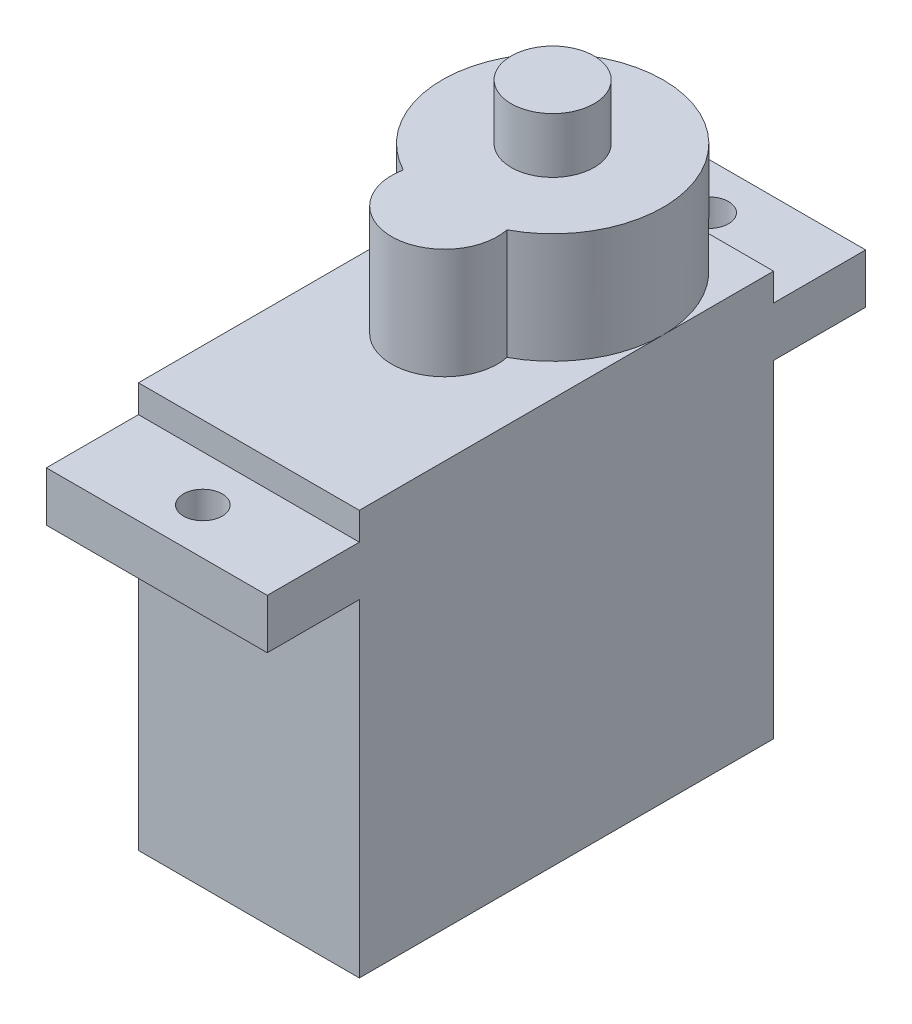
from build123d import *

# Parameters (mm, degrees)
SKETCH1_W           = 5
SKETCH1_H           = 2.7
SKETCH1_W_2         = 14.75
SKETCH1_H_2         = 6
BOSS_EXTRUDE1_DEPTH = 12
CUT_EXTRUDE1_DEPTH  = 6
SKETCH3_R           = 1.05
CUT_EXTRUDE2_DEPTH  = 2.7
SKETCH4_R           = 2.25
BOSS_EXTRUDE3_DEPTH = 3


with BuildPart() as part:
    # Sketch1 → Boss-Extrude1 (new body)
    with BuildSketch(Plane(origin=(0, 0, 0), x_dir=(0, 0, -1), z_dir=(1, 0, 0))):
        Polygon((-11.25, 6.8), (-11.25, -11), (11.25, -11), (11.25, 6.8), (11.25, 9.5), (11.25, 11), (-3.5, 11), (-11.25, 11), (-11.25, 9.5), align=None)
        with Locations((-13.75, 8.15)):
            Rectangle(SKETCH1_W, SKETCH1_H)
        with Locations((13.75, 8.15)):
            Rectangle(SKETCH1_W, SKETCH1_H)
        with Locations((3.875, 14)):
            Rectangle(SKETCH1_W_2, SKETCH1_H_2)
    extrude(amount=BOSS_EXTRUDE1_DEPTH)

    # Sketch2 → Cut-Extrude1 (cut)
    with BuildSketch(Plane(origin=(0, 17, 0), x_dir=(1, 0, 0), z_dir=(0, 1, 0))):
        with BuildLine():
            ThreePointArc((0, 5.25), (1.757359313, 9.492640687), (6, 11.25))
            Line((6, 11.25), (0, 11.25))
            Line((0, 11.25), (0, 5.25))
        make_face()
        with BuildLine():
            Line((12, 11.25), (6, 11.25))
            ThreePointArc((6, 11.25), (10.242640687, 9.492640687), (12, 5.25))
            Line((12, 5.25), (12, 11.25))
        make_face()
        with BuildLine():
            Line((12, -3.5), (12, 5.25))
            ThreePointArc((12, 5.25), (11.142901339, 2.159601026), (8.81647806, -0.04787234))
            ThreePointArc((8.81647806, -0.04787234), (8.860332098, -0.334956403), (8.875, -0.625))
            ThreePointArc((8.875, -0.625), (8.032931996, -2.657931996), (6, -3.5))
            Line((6, -3.5), (12, -3.5))
        make_face()
        with BuildLine():
            ThreePointArc((3.18352194, -0.04787234), (0.857098661, 2.159601026), (0, 5.25))
            Line((0, 5.25), (0, -3.5))
            Line((0, -3.5), (6, -3.5))
            ThreePointArc((6, -3.5), (3.772347983, -2.442468429), (3.18352194, -0.04787234))
        make_face()
    extrude(amount=-CUT_EXTRUDE1_DEPTH, mode=Mode.SUBTRACT)

    # Sketch3 → Cut-Extrude2 (cut)
    with BuildSketch(Plane(origin=(0, 9.5, 0), x_dir=(1, 0, 0), z_dir=(0, 1, 0))):
        with Locations(Location((6, -13.75, 0), (0, 0, 270))):
            Circle(SKETCH3_R)
        with Locations(Location((6, 13.75, 0), (0, 0, 270))):
            Circle(SKETCH3_R)
    extrude(amount=-CUT_EXTRUDE2_DEPTH, mode=Mode.SUBTRACT)

    # Sketch4 → Boss-Extrude3 (add)
    with BuildSketch(Plane(origin=(0, 17, 0), x_dir=(1, 0, 0), z_dir=(0, 1, 0))):
        with Locations(Location((6, 5.25, 0), (0, 0, 270))):
            Circle(SKETCH4_R)
    extrude(amount=BOSS_EXTRUDE3_DEPTH)


solid = part.part
